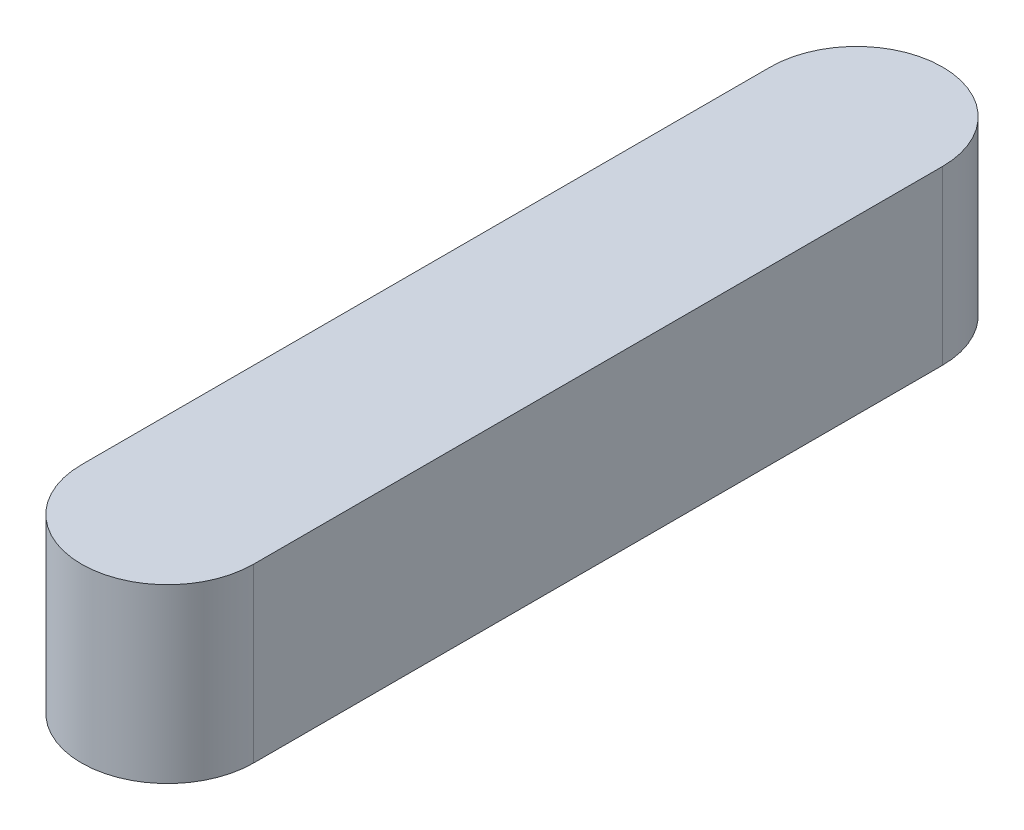
from build123d import *

# Parameters (mm, degrees)
BOSS_EXTRUDE1_DEPTH = 6


with BuildPart() as part:
    # Sketch1 → Boss-Extrude1 (new body)
    with BuildSketch(Plane(origin=(0, 0, 0), x_dir=(1, 0, 0), z_dir=(0, 1, 0))):
        with BuildLine():
            Line((3, 12), (3, -12))
            ThreePointArc((3, -12), (0, -15), (-3, -12))
            Line((-3, -12), (-3, 12))
            ThreePointArc((-3, 12), (0, 15), (3, 12))
        make_face()
    extrude(amount=BOSS_EXTRUDE1_DEPTH)


solid = part.part
